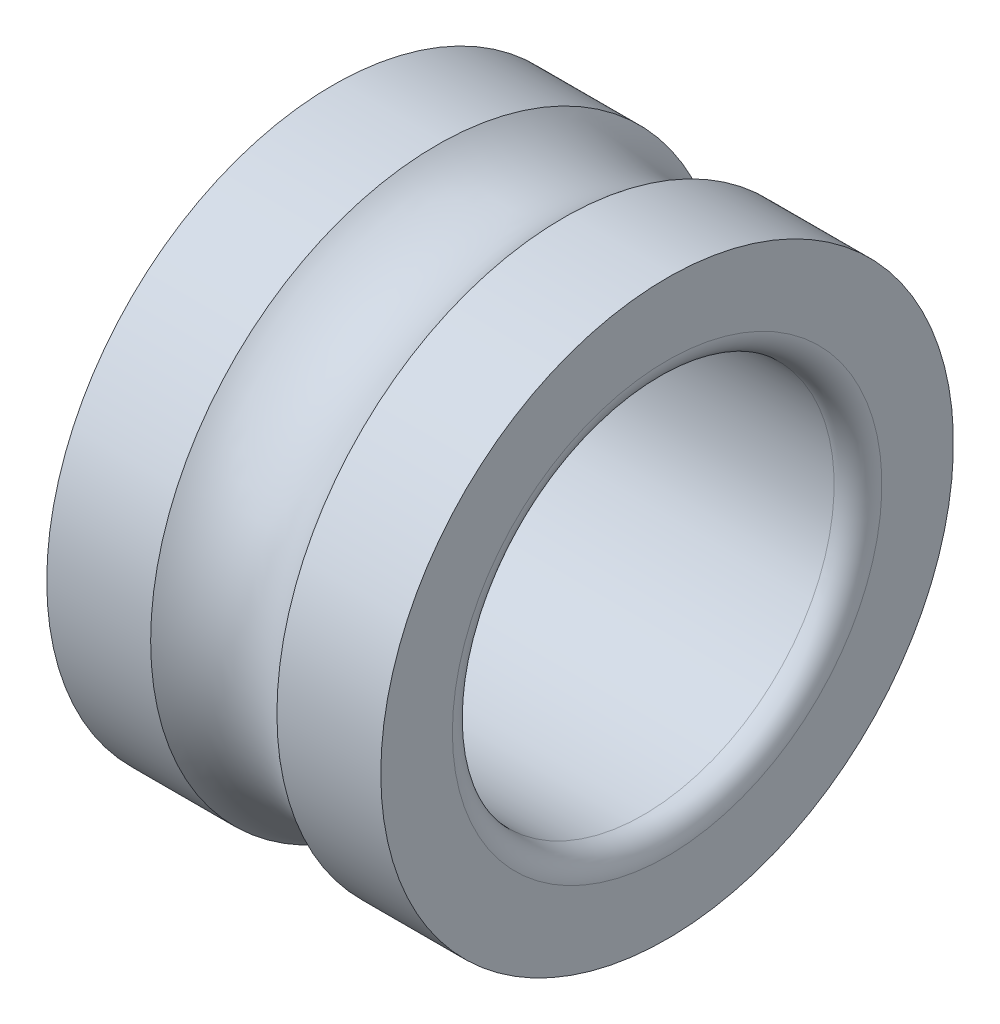
from build123d import *


with BuildPart() as part:
    # Esquisse1 → Base-Révolution (revolve)
    with BuildSketch(Plane.XY):
        with BuildLine():
            Line((-3, 4), (3, 4))
            ThreePointArc((3, 4), (3.353553391, 4.146446609), (3.5, 4.5))
            Line((3.5, 4.5), (3.5, 6))
            Line((3.5, 6), (1.322875656, 6))
            ThreePointArc((1.322875656, 6), (0, 5.5), (-1.322875656, 6))
            Line((-1.322875656, 6), (-3.5, 6))
            Line((-3.5, 6), (-3.5, 4.5))
            ThreePointArc((-3.5, 4.5), (-3.353553391, 4.146446609), (-3, 4))
        make_face()
    revolve(axis=Axis((0, 0, 0), (1, 0, 0)))


solid = part.part
